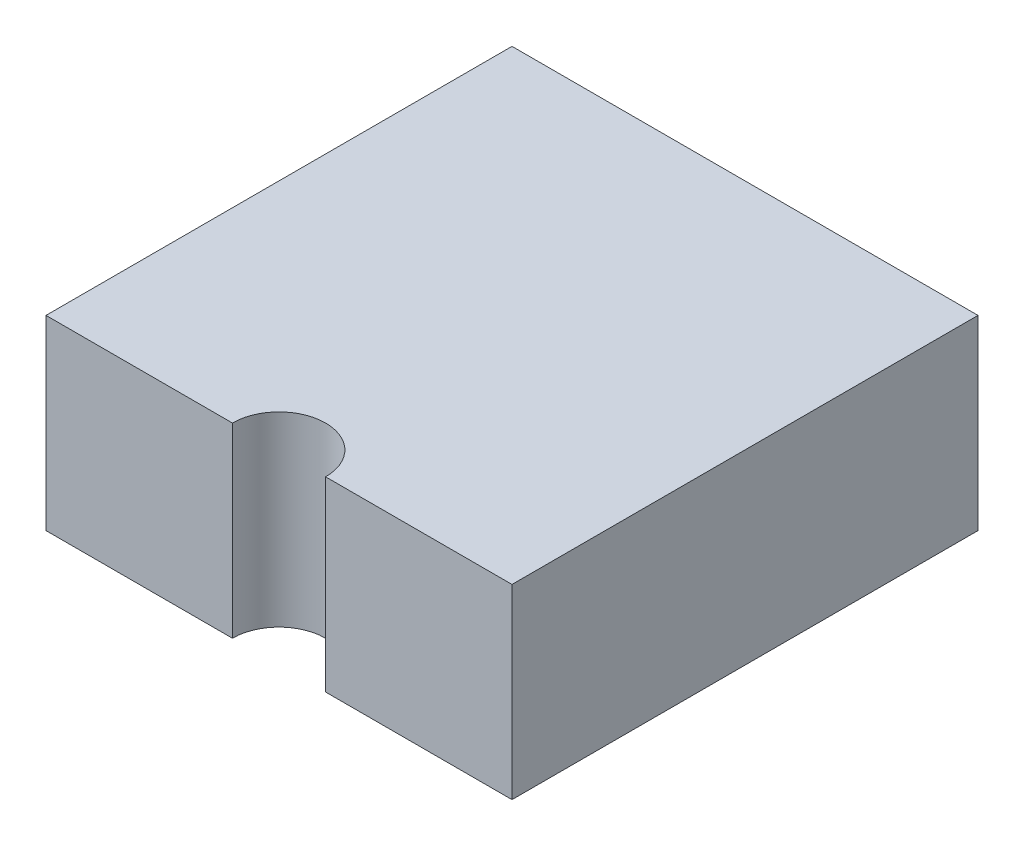
from build123d import *

# Parameters (mm, degrees)
BOSS_EXTRUDE3_DEPTH = 20


with BuildPart() as part:
    # Sketch15 → Boss-Extrude3 (new body)
    with BuildSketch(Plane(origin=(0, 0, 0), x_dir=(1, 0, 0), z_dir=(0, 1, 0))):
        with BuildLine():
            Line((5, -25), (25, -25))
            Line((25, -25), (25, 25))
            Line((25, 25), (-25, 25))
            Line((-25, 25), (-25, -25))
            Line((-25, -25), (-5, -25))
            ThreePointArc((-5, -25), (0, -20), (5, -25))
        make_face()
    extrude(amount=BOSS_EXTRUDE3_DEPTH)


solid = part.part
